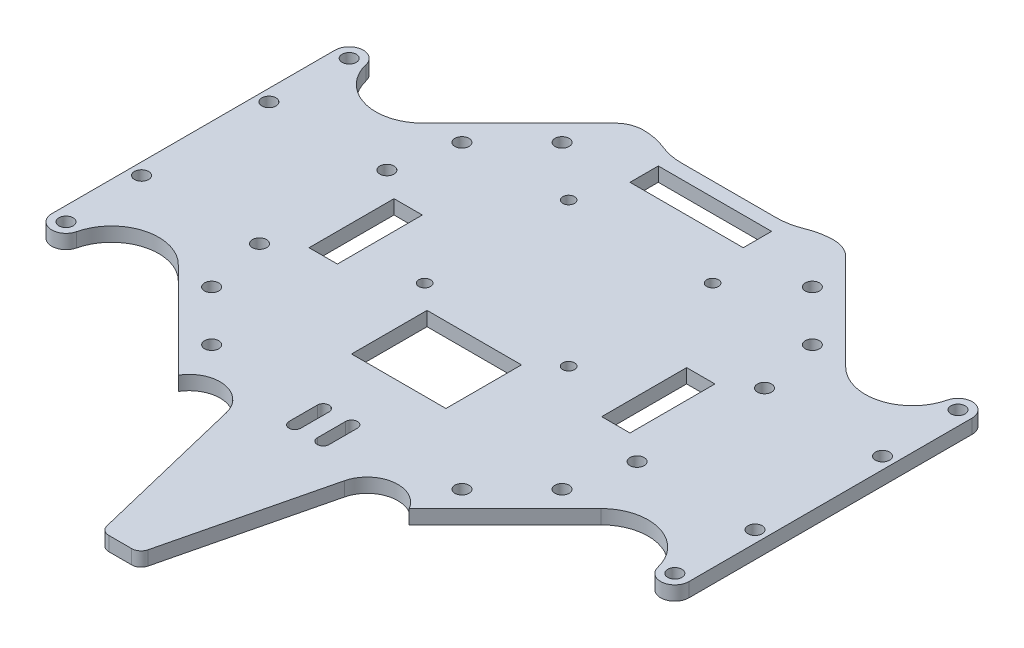
from build123d import *

# Parameters (mm, degrees)
SKETCH_1_R          = 1.5
EXTRUDE_1_DEPTH     = 3
SKETCH_2_R          = 1.5
SKETCH_2_R_2        = 1.25
SKETCH_2_W          = 20
SKETCH_2_H          = 16
CUT_EXTRUDE_1_DEPTH = 31
SKETCH_3_W          = 24
SKETCH_3_H          = 6
SKETCH_3_W_2        = 6
SKETCH_3_H_2        = 18
CUT_EXTRUDE_2_DEPTH = 10
SKETCH_5_R          = 1.5
CUT_EXTRUDE_3_DEPTH = 10
CUT_EXTRUDE_4_DEPTH = 3


with BuildPart() as part:
    # 草图1 → 凸台-拉伸1 (new body)
    with BuildSketch(Plane(origin=(0, 0, 0), x_dir=(1, 0, 0), z_dir=(0, 1, 0))):
        with BuildLine():
            Line((-12.5, -50), (-12.5, -81))
            ThreePointArc((-12.5, -81), (-11.914213562, -82.414213562), (-10.5, -83))
            Line((-10.5, -83), (10.5, -83))
            ThreePointArc((10.5, -83), (11.914213562, -82.414213562), (12.5, -81))
            Line((12.5, -81), (12.5, -50))
            ThreePointArc((12.5, -50), (13.085786438, -48.585786438), (14.5, -48))
            Line((14.5, -48), (67.5, -48))
            Line((67.5, -48), (67.5, 48))
            Line((67.5, 48), (-67.5, 48))
            Line((-67.5, 48), (-67.5, -48))
            Line((-67.5, -48), (-14.5, -48))
            ThreePointArc((-14.5, -48), (-13.085786438, -48.585786438), (-12.5, -50))
        make_face()
        with Locations(Location((-37.123106012, 26.516504294, 0), (0, 0, 270))):
            Circle(SKETCH_1_R, mode=Mode.SUBTRACT)
        with Locations(Location((-26.516504294, 37.123106012, 0), (0, 0, 270))):
            Circle(SKETCH_1_R, mode=Mode.SUBTRACT)
        with Locations(Location((26.516504294, 37.123106012, 0), (0, 0, 90))):
            Circle(SKETCH_1_R, mode=Mode.SUBTRACT)
        with Locations(Location((37.123106012, 26.516504294, 0), (0, 0, 90))):
            Circle(SKETCH_1_R, mode=Mode.SUBTRACT)
        with Locations(Location((37.123106012, -26.516504294, 0), (0, 0, 270))):
            Circle(SKETCH_1_R, mode=Mode.SUBTRACT)
        with Locations(Location((26.516504294, -37.123106012, 0), (0, 0, 270))):
            Circle(SKETCH_1_R, mode=Mode.SUBTRACT)
        with Locations(Location((-37.123106012, -26.516504294, 0), (0, 0, 90))):
            Circle(SKETCH_1_R, mode=Mode.SUBTRACT)
        with Locations(Location((-26.516504294, -37.123106012, 0), (0, 0, 90))):
            Circle(SKETCH_1_R, mode=Mode.SUBTRACT)
    extrude(amount=EXTRUDE_1_DEPTH)

    # 草图2 → 切除-拉伸1 (cut)
    with BuildSketch(Plane(origin=(0, 3, 0), x_dir=(1, 0, 0), z_dir=(0, 1, 0))):
        with Locations(Location((-40, 13.5, 0), (0, 0, 270))):
            Circle(SKETCH_2_R)
        with Locations(Location((-40, -13.5, 0), (0, 0, 270))):
            Circle(SKETCH_2_R)
        with Locations(Location((-65, 13.5, 0), (0, 0, 270))):
            Circle(SKETCH_2_R)
        with Locations(Location((-65, -13.5, 0), (0, 0, 270))):
            Circle(SKETCH_2_R)
        with Locations(Location((40, -13.5, 0), (0, 0, 270))):
            Circle(SKETCH_2_R)
        with Locations(Location((40, 13.5, 0), (0, 0, 270))):
            Circle(SKETCH_2_R)
        with Locations(Location((65, -13.5, 0), (0, 0, 270))):
            Circle(SKETCH_2_R)
        with Locations(Location((65, 13.5, 0), (0, 0, 270))):
            Circle(SKETCH_2_R)
        with Locations(Location((-15.25, 27.25, 0), (0, 0, 270))):
            Circle(SKETCH_2_R_2)
        with Locations(Location((15.25, 27.25, 0), (0, 0, 270))):
            Circle(SKETCH_2_R_2)
        with Locations(Location((15.25, -3.25, 0), (0, 0, 270))):
            Circle(SKETCH_2_R_2)
        with Locations(Location((-15.25, -3.25, 0), (0, 0, 270))):
            Circle(SKETCH_2_R_2)
        with BuildLine():
            Line((4.25, -43), (4.25, -37))
            ThreePointArc((4.25, -37), (3, -35.75), (1.75, -37))
            Line((1.75, -37), (1.75, -43))
            ThreePointArc((1.75, -43), (3, -44.25), (4.25, -43))
        make_face()
        with BuildLine():
            Line((-4.25, -43), (-4.25, -37))
            ThreePointArc((-4.25, -37), (-3, -35.75), (-1.75, -37))
            Line((-1.75, -37), (-1.75, -43))
            ThreePointArc((-1.75, -43), (-3, -44.25), (-4.25, -43))
        make_face()
        with Locations((0, -16)):
            Rectangle(SKETCH_2_W, SKETCH_2_H)
    extrude(amount=-CUT_EXTRUDE_1_DEPTH, mode=Mode.SUBTRACT)

    # 草图3 → 切除-拉伸2 (cut)
    with BuildSketch(Plane(origin=(0, 3, 0), x_dir=(1, 0, 0), z_dir=(0, 1, 0))):
        with Locations((0, 40)):
            Rectangle(SKETCH_3_W, SKETCH_3_H)
        with Locations((31, 0)):
            Rectangle(SKETCH_3_W_2, SKETCH_3_H_2)
        with Locations((-31, 0)):
            Rectangle(SKETCH_3_W_2, SKETCH_3_H_2)
    extrude(amount=-CUT_EXTRUDE_2_DEPTH, mode=Mode.SUBTRACT)

    # 草图5 → 切除-拉伸3 (cut)
    with BuildSketch(Plane(origin=(0, 3, 0), x_dir=(1, 0, 0), z_dir=(0, 1, 0))):
        with Locations(Location((-64.5, 30, 0), (0, 0, 270))):
            Circle(SKETCH_5_R)
        with Locations(Location((64.5, 30, 0), (0, 0, 270))):
            Circle(SKETCH_5_R)
        with Locations(Location((64.5, -30, 0), (0, 0, 270))):
            Circle(SKETCH_5_R)
        with Locations(Location((-64.5, -30, 0), (0, 0, 270))):
            Circle(SKETCH_5_R)
        with BuildLine():
            Line((-24.468037432, 46.242640687), (-44.780190541, 25.930487577))
            ThreePointArc((-44.780190541, 25.930487577), (-54.578308632, 23.380578475), (-61.58105962, 30.692666628))
            ThreePointArc((-61.58105962, 30.692666628), (-64.848696759, 32.979666184), (-67.5, 30))
            Line((-67.5, 30), (-67.5, 48))
            Line((-67.5, 48), (-20.225396744, 48))
            ThreePointArc((-20.225396744, 48), (-22.521497339, 47.543277195), (-24.468037432, 46.242640687))
        make_face()
        with BuildLine():
            Line((67.5, 48), (67.5, 30))
            ThreePointArc((67.5, 30), (64.848696759, 32.979666184), (61.58105962, 30.692666628))
            ThreePointArc((61.58105962, 30.692666628), (54.578308632, 23.380578475), (44.780190541, 25.930487577))
            Line((44.780190541, 25.930487577), (24.468037432, 46.242640687))
            ThreePointArc((24.468037432, 46.242640687), (22.521497339, 47.543277195), (20.225396744, 48))
            Line((20.225396744, 48), (67.5, 48))
        make_face()
        with BuildLine():
            Line((67.5, -48), (67.5, -30))
            ThreePointArc((67.5, -30), (64.848696759, -32.979666184), (61.58105962, -30.692666628))
            ThreePointArc((61.58105962, -30.692666628), (54.578308632, -23.380578475), (44.780190541, -25.930487577))
            Line((44.780190541, -25.930487577), (24.468037432, -46.242640687))
            ThreePointArc((24.468037432, -46.242640687), (22.521497339, -47.543277195), (20.225396744, -48))
            Line((20.225396744, -48), (67.5, -48))
        make_face()
        with BuildLine():
            Line((-20.225396744, -48), (-67.5, -48))
            Line((-67.5, -48), (-67.5, -30))
            ThreePointArc((-67.5, -30), (-64.848696759, -32.979666184), (-61.58105962, -30.692666628))
            ThreePointArc((-61.58105962, -30.692666628), (-54.578308632, -23.380578475), (-44.780190541, -25.930487577))
            Line((-44.780190541, -25.930487577), (-24.468037432, -46.242640687))
            ThreePointArc((-24.468037432, -46.242640687), (-22.521497339, -47.543277195), (-20.225396744, -48))
        make_face()
    extrude(amount=-CUT_EXTRUDE_3_DEPTH, mode=Mode.SUBTRACT)

    # 草图6 → 切除-拉伸4 (cut)
    with BuildSketch(Plane(origin=(0, 3, 0), x_dir=(1, 0, 0), z_dir=(0, 1, 0))):
        with BuildLine():
            Line((-10, 46), (10, 46))
            ThreePointArc((10, 46), (12.547371205, 46.246783902), (15, 46.977957164))
            ThreePointArc((15, 46.977957164), (17.563191705, 47.742091241), (20.225396744, 48))
            Line((20.225396744, 48), (20.225396744, 49))
            Line((20.225396744, 49), (-20.225396744, 49))
            Line((-20.225396744, 49), (-20.225396744, 48))
            ThreePointArc((-20.225396744, 48), (-17.563191705, 47.742091241), (-15, 46.977957164))
            ThreePointArc((-15, 46.977957164), (-12.547371205, 46.246783902), (-10, 46))
        make_face()
        with BuildLine():
            Line((-4.371087012, -81.471994656), (-12.5, -48))
            ThreePointArc((-12.5, -48), (-17.891385365, -43.085345419), (-24.468037432, -46.242640687))
            Line((-24.468037432, -46.242640687), (-24.468037432, -84))
            Line((-24.468037432, -84), (24.468037432, -84))
            Line((24.468037432, -84), (24.468037432, -46.242640687))
            ThreePointArc((24.468037432, -46.242640687), (17.891385365, -43.085345419), (12.5, -48))
            Line((12.5, -48), (4.371087012, -81.471994656))
            ThreePointArc((4.371087012, -81.471994656), (3.663704737, -82.572257821), (2.427579604, -83))
            Line((2.427579604, -83), (-2.427579604, -83))
            ThreePointArc((-2.427579604, -83), (-3.663704737, -82.572257821), (-4.371087012, -81.471994656))
        make_face()
    extrude(amount=-CUT_EXTRUDE_4_DEPTH, mode=Mode.SUBTRACT)


solid = part.part
